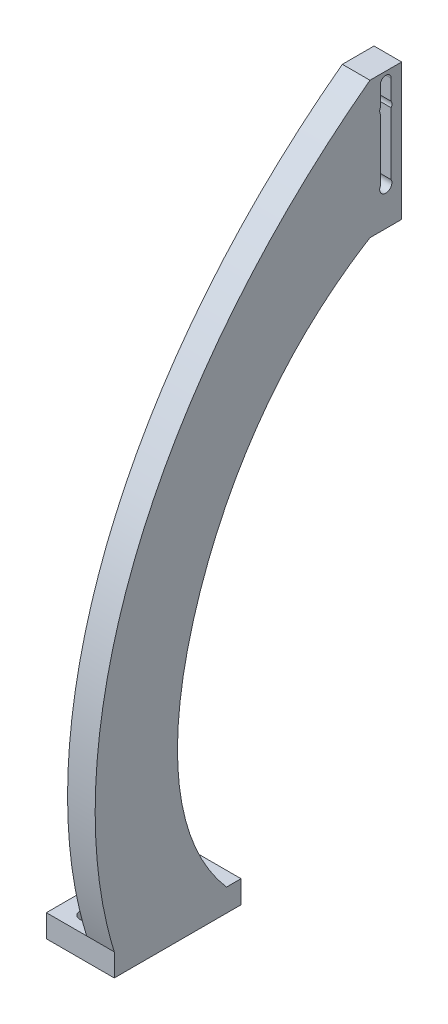
from build123d import *

# Parameters (mm, degrees)
SKETCH_1_W           = 20
SKETCH_1_H           = 28
SKETCH_1_R           = 1.6
EXTRUDE_1_DEPTH      = 5
EXTRUDE_2_DEPTH      = 5
EXTRUDE_2_DEPTH_BACK = 1.1
SKETCH_3_W           = 6.1
SKETCH_3_H           = 30.125226912
EXTRUDE_3_DEPTH      = 7
SKETCH_4_R           = 1.35
CUT_EXTRUDE_1_DEPTH  = 7
SKETCH_5_W           = 5
SKETCH_5_H           = 28
CUT_EXTRUDE_2_DEPTH  = 10
CUT_EXTRUDE_3_DEPTH  = 10


with BuildPart() as part:
    # 草图1 → 凸台-拉伸1 (new body)
    with BuildSketch(Plane(origin=(0, 0, 0), x_dir=(1, 0, 0), z_dir=(0, 1, 0))):
        Rectangle(SKETCH_1_W, SKETCH_1_H)
        with Locations(Location((-5, 10, 0), (0, 0, 270))):
            Circle(SKETCH_1_R, mode=Mode.SUBTRACT)
        with Locations(Location((-5, -10, 0), (0, 0, 90))):
            Circle(SKETCH_1_R, mode=Mode.SUBTRACT)
    extrude(amount=EXTRUDE_1_DEPTH)

    # 草图2 → 凸台-拉伸2 (add, two sides: drawn at the far end of the back side and taken through both)
    with BuildSketch(Plane(origin=(0, 0, 0), x_dir=(0, 0, -1), z_dir=(1, 0, 0)).offset(-EXTRUDE_2_DEPTH_BACK)):
        with BuildLine():
            Line((42.482395746, 143.5), (42.482395746, 113.374773088))
            add(Edge.make_bspline(
                [(10.794309538, 5), (-3.625508376, 21.700163207), (-0.038874902, 68.530494039), (24.786643579, 102.563540472), (42.482395746, 113.374773088)],
                knots=[0, 0, 0, 0, 0.510479212, 1, 1, 1, 1], degree=3))
            Line((10.794309538, 5), (-14, 5))
            add(Edge.make_bspline(
                [(-14, 5), (-21.090980053, 28.072383436), (-16.059602837, 83.599622922), (19.318940175, 126.307389699), (42.482395746, 143.5)],
                knots=[0, 0, 0, 0, 0.452386754, 1, 1, 1, 1], degree=3))
        make_face()
    extrude(amount=EXTRUDE_2_DEPTH + EXTRUDE_2_DEPTH_BACK)

    # 草图3 → 凸台-拉伸3 (add)
    with BuildSketch(Plane(origin=(0, 0, -42.482395746), x_dir=(-1, 0, 0), z_dir=(0, 0, -1))):
        with Locations((-1.95, 128.437386544)):
            Rectangle(SKETCH_3_W, SKETCH_3_H)
    extrude(amount=EXTRUDE_3_DEPTH)

    # 草图4 → 切除-拉伸1 (cut)
    with BuildSketch(Plane(origin=(5, 0, 0), x_dir=(0, 0, -1), z_dir=(1, 0, 0))):
        with Locations((45.982395746, 136.5)):
            Circle(SKETCH_4_R)
        with Locations((45.982395746, 121.5)):
            Circle(SKETCH_4_R)
    extrude(amount=-CUT_EXTRUDE_1_DEPTH, mode=Mode.SUBTRACT)

    # 草图5 → 切除-拉伸2 (cut)
    with BuildSketch(Plane(origin=(0, 5, 0), x_dir=(1, 0, 0), z_dir=(0, 1, 0))):
        with Locations((7.5, 0)):
            Rectangle(SKETCH_5_W, SKETCH_5_H)
    extrude(amount=-CUT_EXTRUDE_2_DEPTH, mode=Mode.SUBTRACT)

    # 草图6 → 切除-拉伸3 (cut)
    with BuildSketch(Plane(origin=(5, 0, 0), x_dir=(0, 0, -1), z_dir=(1, 0, 0))):
        with BuildLine():
            Line((44.782395746, 121.5), (44.782395746, 141.5))
            ThreePointArc((44.782395746, 141.5), (45.982395746, 142.7), (47.182395746, 141.5))
            Line((47.182395746, 141.5), (47.182395746, 121.5))
            ThreePointArc((47.182395746, 121.5), (45.982395746, 120.3), (44.782395746, 121.5))
        make_face()
    extrude(amount=-CUT_EXTRUDE_3_DEPTH, mode=Mode.SUBTRACT)


solid = part.part
